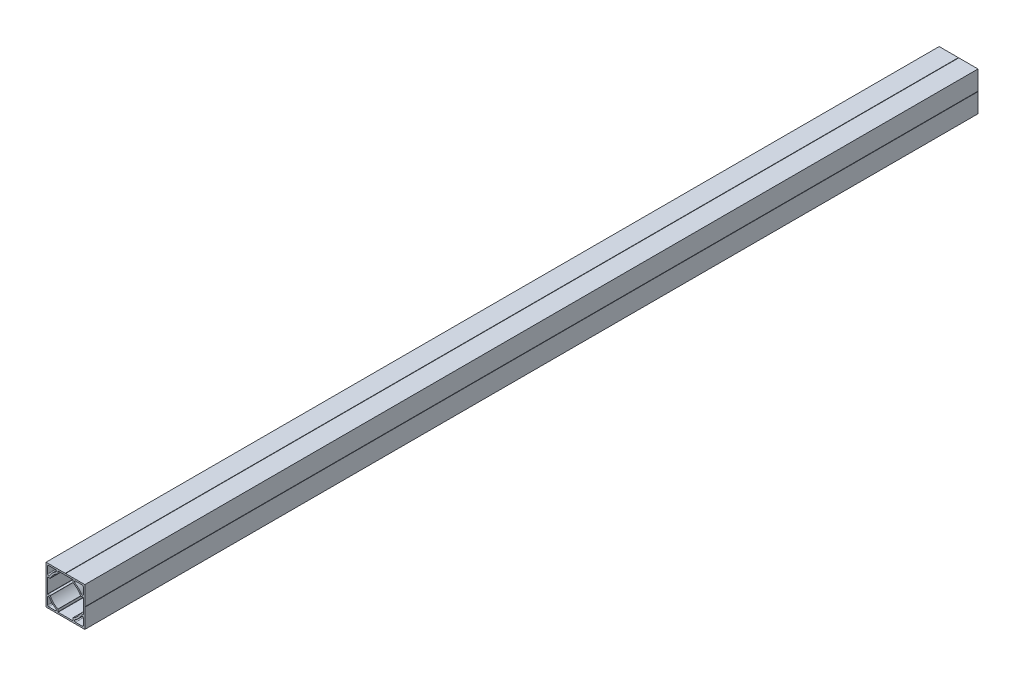
from build123d import *

# Parameters (mm, degrees)
BOSS_EXTRUDE1_DEPTH = 584.2


with BuildPart() as part:
    # Sketch1 → Boss-Extrude1 (new body)
    with BuildSketch(Plane.XY):
        Polygon((25.4, 12.827), (25.4, 25.4), (12.827, 25.4), (12.7, 25.273), (12.573, 25.4), (0, 25.4), (0, 12.827), (0.127, 12.7), (0, 12.573), (0, 0), (12.573, 0), (12.7, 0.127), (12.827, 0), (25.4, 0), (25.4, 12.573), (25.273, 12.7), align=None)
        with BuildLine():
            Line((1.707589026, 1.016), (6.102910974, 1.016))
            ThreePointArc((6.102910974, 1.016), (6.769395501, 1.522944081), (6.458795739, 2.30058263))
            ThreePointArc((6.458795739, 2.30058263), (4.123855404, 4.123855404), (2.30058263, 6.458795739))
            ThreePointArc((2.30058263, 6.458795739), (1.522944081, 6.769395501), (1.016, 6.102910974))
            Line((1.016, 6.102910974), (1.016, 1.707589026))
            ThreePointArc((1.016, 1.707589026), (1.218561736, 1.218561736), (1.707589026, 1.016))
        make_face(mode=Mode.SUBTRACT)
        with BuildLine():
            Line((1.143, 7.8105), (2.642113144, 7.8105))
            ThreePointArc((2.642113144, 7.8105), (2.708934476, 7.791499581), (2.755761583, 7.740183616))
            ThreePointArc((2.755761583, 7.740183616), (4.842275894, 4.842275894), (7.740183616, 2.755761583))
            ThreePointArc((7.740183616, 2.755761583), (7.791499582, 2.708934476), (7.8105, 2.642113144))
            Line((7.8105, 2.642113144), (7.8105, 1.143))
            ThreePointArc((7.8105, 1.143), (7.847697439, 1.053197439), (7.9375, 1.016))
            Line((7.9375, 1.016), (17.4625, 1.016))
            ThreePointArc((17.4625, 1.016), (17.552302561, 1.053197439), (17.5895, 1.143))
            Line((17.5895, 1.143), (17.5895, 2.642113144))
            ThreePointArc((17.5895, 2.642113144), (17.608500419, 2.708934476), (17.659816384, 2.755761583))
            ThreePointArc((17.659816384, 2.755761583), (20.557724106, 4.842275894), (22.644238417, 7.740183616))
            ThreePointArc((22.644238417, 7.740183616), (22.691065524, 7.791499582), (22.757886856, 7.8105))
            Line((22.757886856, 7.8105), (24.257, 7.8105))
            ThreePointArc((24.257, 7.8105), (24.346802561, 7.847697439), (24.384, 7.9375))
            Line((24.384, 7.9375), (24.384, 17.4625))
            ThreePointArc((24.384, 17.4625), (24.346802561, 17.552302561), (24.257, 17.5895))
            Line((24.257, 17.5895), (22.757886856, 17.5895))
            ThreePointArc((22.757886856, 17.5895), (22.691065524, 17.608500419), (22.644238417, 17.659816384))
            ThreePointArc((22.644238417, 17.659816384), (20.557724106, 20.557724106), (17.659816384, 22.644238417))
            ThreePointArc((17.659816384, 22.644238417), (17.608500418, 22.691065524), (17.5895, 22.757886856))
            Line((17.5895, 22.757886856), (17.5895, 24.257))
            ThreePointArc((17.5895, 24.257), (17.552302561, 24.346802561), (17.4625, 24.384))
            Line((17.4625, 24.384), (7.9375, 24.384))
            ThreePointArc((7.9375, 24.384), (7.847697439, 24.346802561), (7.8105, 24.257))
            Line((7.8105, 24.257), (7.8105, 22.757886856))
            ThreePointArc((7.8105, 22.757886856), (7.791499581, 22.691065524), (7.740183616, 22.644238417))
            ThreePointArc((7.740183616, 22.644238417), (4.842275894, 20.557724106), (2.755761583, 17.659816384))
            ThreePointArc((2.755761583, 17.659816384), (2.708934476, 17.608500418), (2.642113144, 17.5895))
            Line((2.642113144, 17.5895), (1.143, 17.5895))
            ThreePointArc((1.143, 17.5895), (1.053197439, 17.552302561), (1.016, 17.4625))
            Line((1.016, 17.4625), (1.016, 7.9375))
            ThreePointArc((1.016, 7.9375), (1.053197439, 7.847697439), (1.143, 7.8105))
        make_face(mode=Mode.SUBTRACT)
        with BuildLine():
            Line((1.016, 23.692410974), (1.016, 19.297089026))
            ThreePointArc((1.016, 19.297089026), (1.522944081, 18.630604499), (2.30058263, 18.941204261))
            ThreePointArc((2.30058263, 18.941204261), (4.123855404, 21.276144596), (6.458795739, 23.09941737))
            ThreePointArc((6.458795739, 23.09941737), (6.769395501, 23.877055919), (6.102910974, 24.384))
            Line((6.102910974, 24.384), (1.707589026, 24.384))
            ThreePointArc((1.707589026, 24.384), (1.218561736, 24.181438264), (1.016, 23.692410974))
        make_face(mode=Mode.SUBTRACT)
        with BuildLine():
            Line((23.692410974, 24.384), (19.297089026, 24.384))
            ThreePointArc((19.297089026, 24.384), (18.630604499, 23.877055919), (18.941204261, 23.09941737))
            ThreePointArc((18.941204261, 23.09941737), (21.276144596, 21.276144596), (23.09941737, 18.941204261))
            ThreePointArc((23.09941737, 18.941204261), (23.877055919, 18.630604499), (24.384, 19.297089026))
            Line((24.384, 19.297089026), (24.384, 23.692410974))
            ThreePointArc((24.384, 23.692410974), (24.181438264, 24.181438264), (23.692410974, 24.384))
        make_face(mode=Mode.SUBTRACT)
        with BuildLine():
            Line((24.384, 1.707589026), (24.384, 6.102910974))
            ThreePointArc((24.384, 6.102910974), (23.877055919, 6.769395501), (23.09941737, 6.458795739))
            ThreePointArc((23.09941737, 6.458795739), (21.276144596, 4.123855404), (18.941204261, 2.30058263))
            ThreePointArc((18.941204261, 2.30058263), (18.630604499, 1.522944081), (19.297089026, 1.016))
            Line((19.297089026, 1.016), (23.692410974, 1.016))
            ThreePointArc((23.692410974, 1.016), (24.181438264, 1.218561736), (24.384, 1.707589026))
        make_face(mode=Mode.SUBTRACT)
    extrude(amount=BOSS_EXTRUDE1_DEPTH)


solid = part.part
